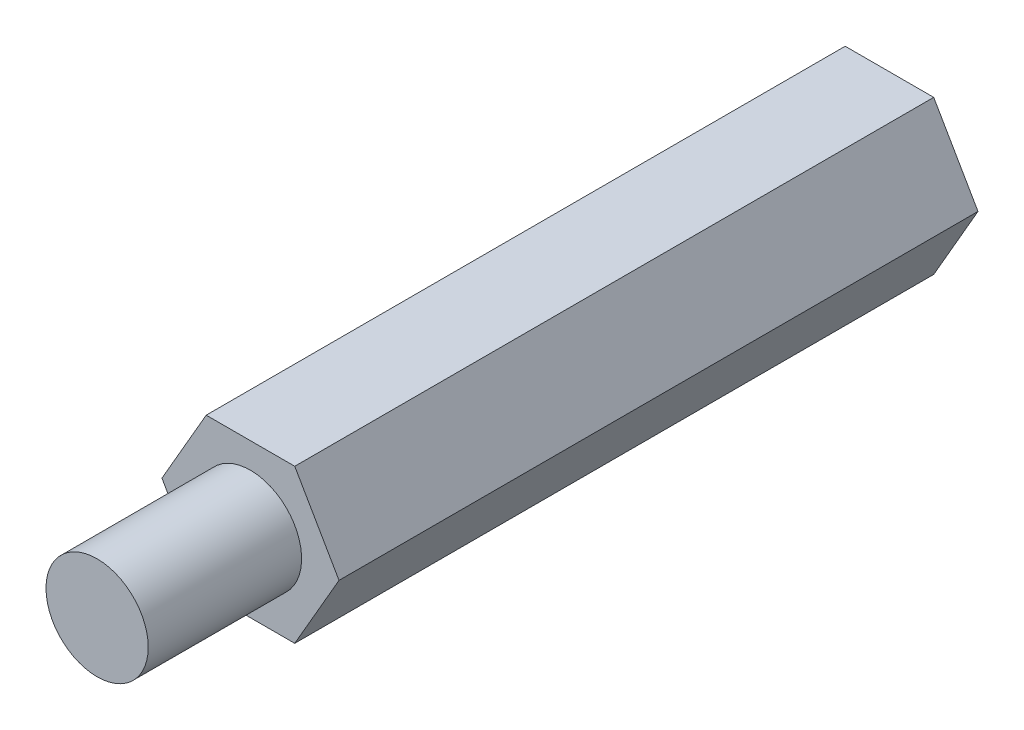
from build123d import *

# Parameters (mm, degrees)
EXTRUDE_1_DEPTH        = 25
SKETCH_2_R             = 2
EXTRUDE_2_DEPTH        = 6
HOLE_WIZARD_M4_1_D     = 3.3
HOLE_WIZARD_M4_1_DEPTH = 11.5
HOLE_WIZARD_M4_1_TIP   = 0.991420021


with BuildPart() as part:
    # 草图1 → 拉伸1 (new body)
    with BuildSketch(Plane.XY):
        Polygon((1.732050808, -3), (3.464101615, 0), (1.732050808, 3), (-1.732050808, 3), (-3.464101615, 0), (-1.732050808, -3), align=None)
    extrude(amount=EXTRUDE_1_DEPTH)

    # 草图2 → 拉伸2 (add)
    with BuildSketch(Plane.XY.offset(25)):
        with Locations(Location((0, 0, 0), (0, 0, 180))):
            Circle(SKETCH_2_R)
    extrude(amount=EXTRUDE_2_DEPTH)

    # M4 螺纹孔1
    with Locations(Plane(origin=(0, 0, 0), x_dir=(-1, 0, 0), z_dir=(0, 0, -1))):
        with Locations((0, 0)):
            Hole(HOLE_WIZARD_M4_1_D / 2, depth=HOLE_WIZARD_M4_1_DEPTH)
            with Locations((0, 0, -(HOLE_WIZARD_M4_1_DEPTH + HOLE_WIZARD_M4_1_TIP / 2))):  # 118° drill point
                Cone(0, HOLE_WIZARD_M4_1_D / 2, HOLE_WIZARD_M4_1_TIP, mode=Mode.SUBTRACT)


solid = part.part
